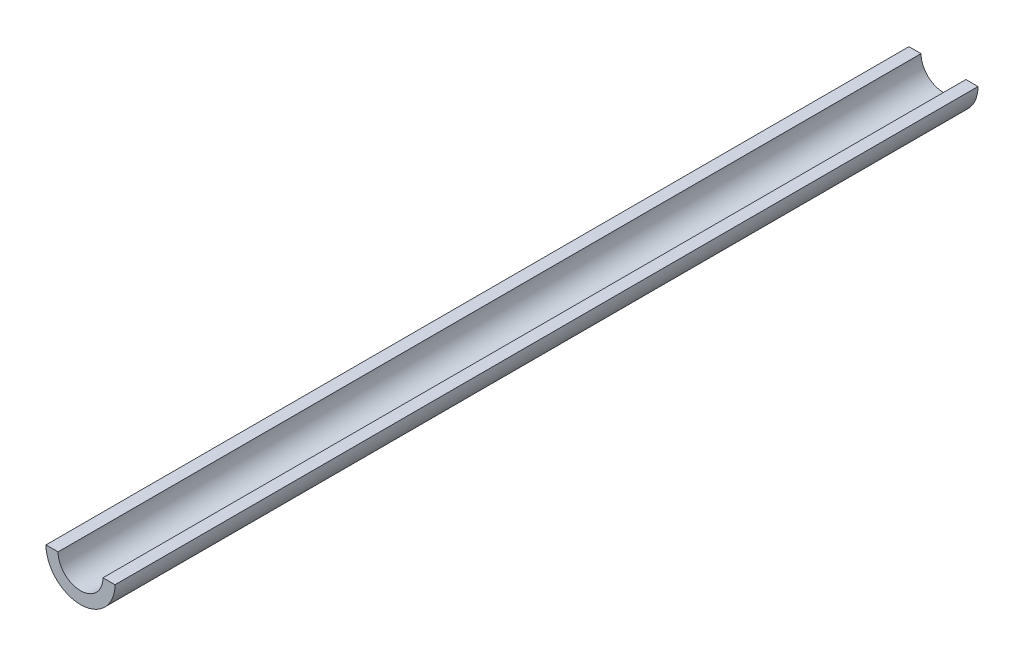
from build123d import *

# Parameters (mm, degrees)
EXTRUDE_1_DEPTH = 250


with BuildPart() as part:
    # 草图3 → 凸台-拉伸1 (new body)
    with BuildSketch(Plane.XY):
        with BuildLine():
            Line((-10, 0), (-6.5, 0))
            ThreePointArc((-6.5, 0), (0, -6.5), (6.5, 0))
            Line((6.5, 0), (10, 0))
            ThreePointArc((10, 0), (0, -10), (-10, 0))
        make_face()
    extrude(amount=EXTRUDE_1_DEPTH)


solid = part.part
